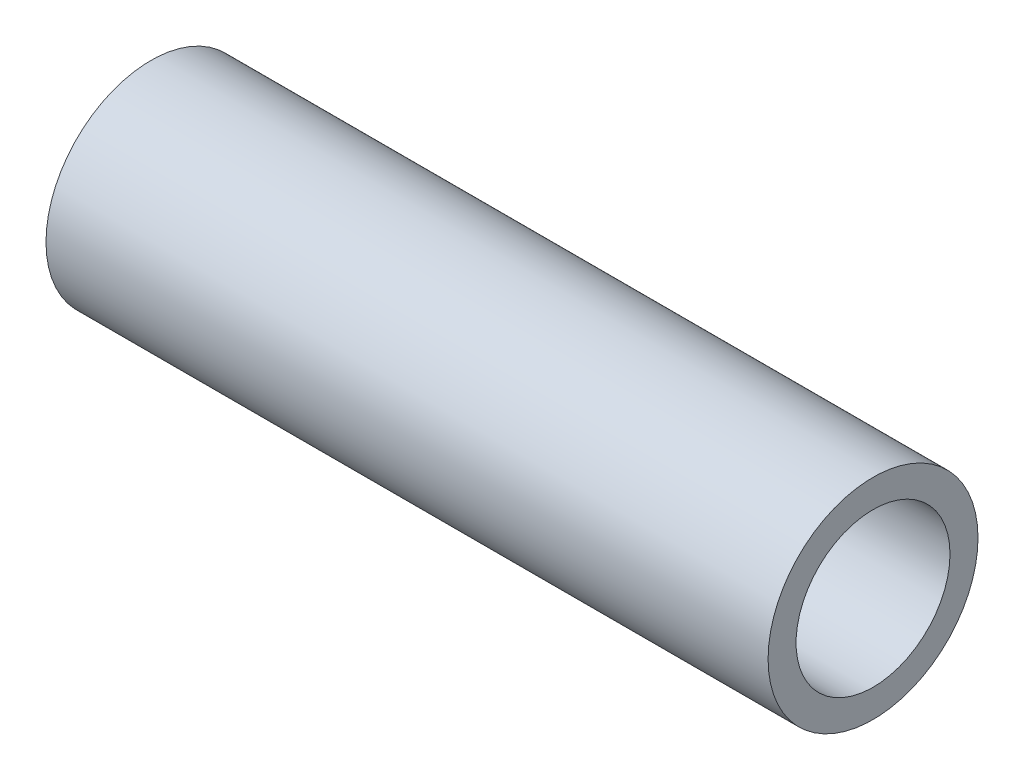
from build123d import *

# Parameters (mm, degrees)
SWEEP_THIN1_PROFILE_R   = 9.525
SWEEP_THIN1_PROFILE_R_2 = 6.985


with BuildPart() as part:
    # Sweep-Thin1: sweep along a curve in space
    with BuildLine() as sweep_thin1_path:
        Line((-32.766, 0, 0), (32.766, 0, 0))
    # Sweep-Thin1 profile (on start of the path) → Sweep-Thin1 (sweep)
    with BuildSketch(Plane(origin=(-32.766, 0, 0), x_dir=(0, 0, 1), z_dir=(1, 0, 0))):
        Circle(SWEEP_THIN1_PROFILE_R)
        Circle(SWEEP_THIN1_PROFILE_R_2, mode=Mode.SUBTRACT)
    sweep(path=sweep_thin1_path.line)


solid = part.part
